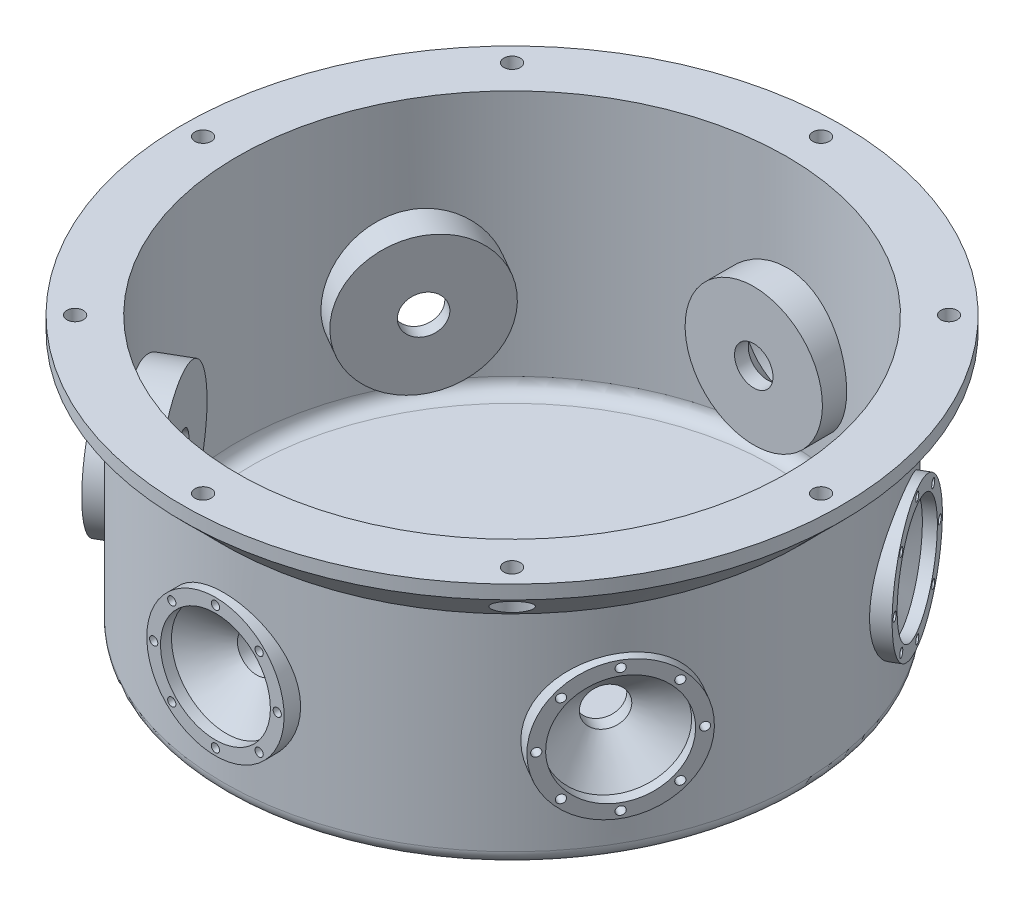
from build123d import *

# Parameters (mm, degrees)
SKETCH2_R           = 3
CUT_EXTRUDE1_DEPTH  = 197.977156036
CUT_EXTRUDE2_START  = -5
SKETCH2_3_R         = 6
SKETCH2_3_R_2       = 3
CUT_EXTRUDE2_DEPTH  = 192.977156158
CIRPATTERN1_COUNT   = 8
SKETCH3_R           = 25
CUT_EXTRUDE3_DEPTH  = 197.977156158
SKETCH10_R          = 1.5
CUT_EXTRUDE6_DEPTH  = 4
CIRPATTERN2_COUNT   = 6
FILLET2_R           = 5
SKETCH12_R          = 16
SKETCH12_R_2        = 8
BOSS_EXTRUDE2_DEPTH = 25
FILLET5_R           = 5


with BuildPart() as part:
    # Sketch1 → Revolve1 (revolve)
    with BuildSketch(Plane.XY):
        Polygon((0, 0), (-105, 0), (-105, 80), (-120, 95), (-120, 100), (-100, 100), (-100, 5), (0, 5), align=None)
    revolve(axis=Axis((0, 0, 0), (0, 1, 0)))

    # Sketch2 → Cut-Extrude1 (cut, through all)
    with BuildSketch(Plane(origin=(0, 100, 0), x_dir=(1, 0, 0), z_dir=(0, 1, 0))):
        with Locations((0, 112.5)):
            Circle(SKETCH2_R)
    cut_extrude1 = extrude(amount=-CUT_EXTRUDE1_DEPTH, mode=Mode.SUBTRACT)

    # Sketch2<3> → Cut-Extrude2 (cut, through all)
    with BuildSketch(Plane(origin=(0, 100, 0), x_dir=(1, 0, 0), z_dir=(0, 1, 0)).offset(CUT_EXTRUDE2_START)):
        with Locations((0, 112.5)):
            Circle(SKETCH2_3_R)
        with Locations((0, 112.5)):
            Circle(SKETCH2_3_R_2, mode=Mode.SUBTRACT)
    cut_extrude2 = extrude(amount=-CUT_EXTRUDE2_DEPTH, mode=Mode.SUBTRACT)

    # CirPattern1: Cut-Extrude1, Cut-Extrude2 ×8 about axis
    cirpattern1_axis = Axis((0, 100, 0), (0, -1, 0))
    add([cut_extrude1.rotate(cirpattern1_axis, i * 360 / CIRPATTERN1_COUNT) for i in range(1, CIRPATTERN1_COUNT)], mode=Mode.SUBTRACT)
    add([cut_extrude2.rotate(cirpattern1_axis, i * 360 / CIRPATTERN1_COUNT) for i in range(1, CIRPATTERN1_COUNT)], mode=Mode.SUBTRACT)

    # Sketch3 → Cut-Extrude3 (cut, through all)
    with BuildSketch(Plane.XY):
        with Locations((0, 40)):
            Circle(SKETCH3_R)
    cut_extrude3 = extrude(amount=CUT_EXTRUDE3_DEPTH, mode=Mode.SUBTRACT)

    # Sketch7 → Revolve2 (revolve)
    with BuildSketch(Plane(origin=(0, 0, 0), x_dir=(0, 0, -1), z_dir=(1, 0, 0))):
        Polygon((-108, 60), (-104, 60), (-93, 47), (-88, 47), (-88, 65), (-108, 65), align=None)
    revolve2 = revolve(axis=Axis((0, 40, -17.468952462), (0, 0, 1)))

    # Sketch10 → Cut-Extrude6 (cut)
    with BuildSketch(Plane.XY.offset(108)):
        with Locations((0, 62.5)):
            Circle(SKETCH10_R)
        with Locations((15.909902577, 55.909902577)):
            Circle(SKETCH10_R)
        with Locations((22.5, 40)):
            Circle(SKETCH10_R)
        with Locations((15.909902577, 24.090097423)):
            Circle(SKETCH10_R)
        with Locations((0, 17.5)):
            Circle(SKETCH10_R)
        with Locations((-15.909902577, 24.090097423)):
            Circle(SKETCH10_R)
        with Locations((-22.5, 40)):
            Circle(SKETCH10_R)
        with Locations((-15.909902577, 55.909902577)):
            Circle(SKETCH10_R)
    cut_extrude6 = extrude(amount=-CUT_EXTRUDE6_DEPTH, mode=Mode.SUBTRACT)

    # CirPattern2: Cut-Extrude3, Revolve2, Cut-Extrude6 ×6 about axis
    cirpattern2_axis = Axis((0, 100, 0), (0, -1, 0))
    add([cut_extrude3.rotate(cirpattern2_axis, i * 360 / CIRPATTERN2_COUNT) for i in range(1, CIRPATTERN2_COUNT)], mode=Mode.SUBTRACT)
    add([revolve2.rotate(cirpattern2_axis, i * 360 / CIRPATTERN2_COUNT) for i in range(1, CIRPATTERN2_COUNT)])
    add([cut_extrude6.rotate(cirpattern2_axis, i * 360 / CIRPATTERN2_COUNT) for i in range(1, CIRPATTERN2_COUNT)], mode=Mode.SUBTRACT)

    # Fillet2
    fillet2_edges = [part.edges().sort_by_distance(p)[0] for p in [
        (100, 5, 0),
        (105, 0, 0),
    ]]
    fillet(fillet2_edges, radius=FILLET2_R)

    # Sketch12 → Boss-Extrude2 (add)
    with BuildSketch(Plane.XZ):
        Circle(SKETCH12_R)
        Circle(SKETCH12_R_2, mode=Mode.SUBTRACT)
    extrude(amount=BOSS_EXTRUDE2_DEPTH)

    # Fillet5
    fillet5_edges = [part.edges().sort_by_distance(p)[0] for p in [
        (-16, 0, 0),
    ]]
    fillet(fillet5_edges, radius=FILLET5_R)


solid = part.part
